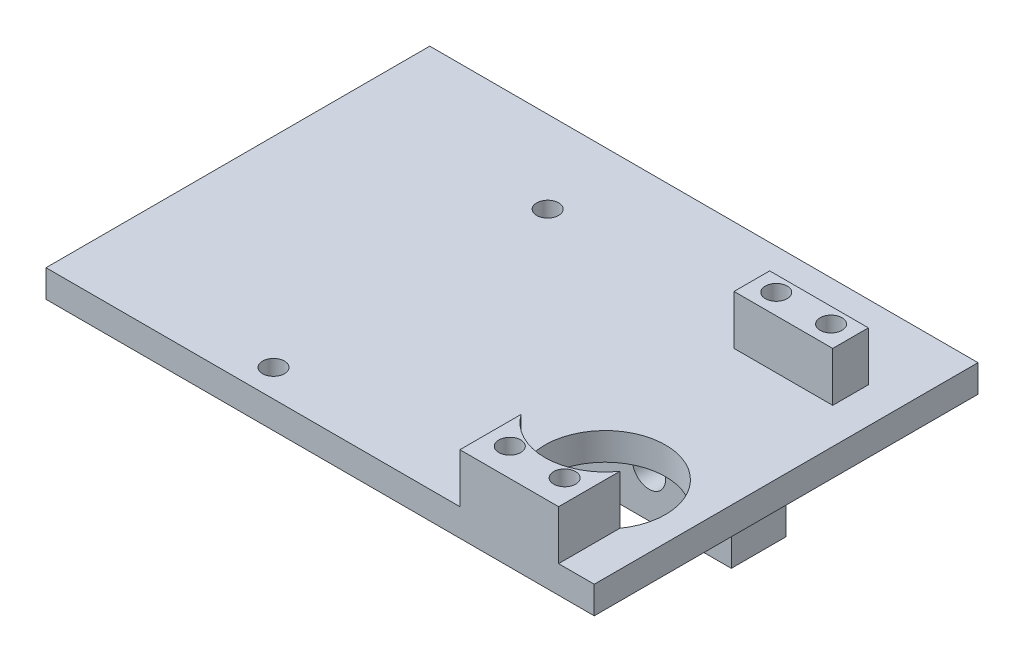
from build123d import *

# Parameters (mm, degrees)
SKETCH1_W           = 100
SKETCH1_H           = 70
SKETCH1_R           = 11
BOSS_EXTRUDE1_DEPTH = 5
SKETCH2_W           = 18
SKETCH2_H           = 6.5
BOSS_EXTRUDE2_DEPTH = 9
SKETCH3_R           = 2
CUT_EXTRUDE1_DEPTH  = 3
SKETCH4_R           = 3
BOSS_EXTRUDE4_DEPTH = 10
FILLET2_R           = 3
SKETCH5_R           = 2
CUT_EXTRUDE2_DEPTH  = 5


with BuildPart() as part:
    # Sketch1 → Boss-Extrude1 (new body)
    with BuildSketch(Plane(origin=(0, 0, 0), x_dir=(1, 0, 0), z_dir=(0, 1, 0))):
        Rectangle(SKETCH1_W, SKETCH1_H)
        with Locations(Location((34.5, -17.5, 0), (0, 0, 270))):
            Circle(SKETCH1_R, mode=Mode.SUBTRACT)
    extrude(amount=BOSS_EXTRUDE1_DEPTH)

    # Sketch2 → Boss-Extrude2 (add)
    with BuildSketch(Plane(origin=(0, 5, 0), x_dir=(1, 0, 0), z_dir=(0, 1, 0))):
        with BuildLine():
            Line((25.5, -35), (25.5, -23.82455532))
            ThreePointArc((25.5, -23.82455532), (34.5, -28.5), (43.5, -23.82455532))
            Line((43.5, -23.82455532), (43.5, -35))
            Line((43.5, -35), (25.5, -35))
        make_face()
        with Locations((34.5, 18.25)):
            Rectangle(SKETCH2_W, SKETCH2_H)
    extrude(amount=BOSS_EXTRUDE2_DEPTH)

    # Sketch3 → Cut-Extrude1 (cut)
    with BuildSketch(Plane(origin=(0, 14, 0), x_dir=(1, 0, 0), z_dir=(0, 1, 0))):
        with Locations(Location((29.5, -29.9, 0), (0, 0, 270))):
            Circle(SKETCH3_R)
        with Locations(Location((39.5, -29.9, 0), (0, 0, 270))):
            Circle(SKETCH3_R)
        with Locations(Location((39.5, 18.7, 0), (0, 0, 270))):
            Circle(SKETCH3_R)
        with Locations(Location((29.5, 18.7, 0), (0, 0, 270))):
            Circle(SKETCH3_R)
    extrude(amount=-CUT_EXTRUDE1_DEPTH, mode=Mode.SUBTRACT)

    # Sketch4 → Boss-Extrude4 (add)
    # profile 1 of 3: a face of its own
    with BuildSketch(Plane(origin=(0, 0, -35), x_dir=(-1, 0, 0), z_dir=(0, 0, -1))):
        Polygon((-15, -40), (15, -40), (15, -7), (15, 0), (-15, 0), (-15, -7), align=None)
        with Locations((0, -32)):
            Circle(SKETCH4_R, mode=Mode.SUBTRACT)
        with Locations((0, -8)):
            Circle(SKETCH4_R, mode=Mode.SUBTRACT)
    # profile 2 of 3: a face of its own
    with BuildSketch(Plane(origin=(0, 0, -35), x_dir=(-1, 0, 0), z_dir=(0, 0, -1))):
        Polygon((-50, 0), (-15, -7), (-15, 0), align=None)
    # profile 3 of 3: a face of its own
    with BuildSketch(Plane(origin=(0, 0, -35), x_dir=(-1, 0, 0), z_dir=(0, 0, -1))):
        Polygon((15, 0), (15, -7), (50, 0), align=None)
    extrude(amount=-BOSS_EXTRUDE4_DEPTH)

    # Fillet2
    fillet2_edges = [part.edges().sort_by_distance(p)[0] for p in [
        (15, -7, -30),
        (-15, -7, -30),
        (0, 0, -25),
    ]]
    fillet(fillet2_edges, radius=FILLET2_R)

    # Sketch5 → Cut-Extrude2 (cut)
    with BuildSketch(Plane(origin=(0, 5, 0), x_dir=(1, 0, 0), z_dir=(0, 1, 0))):
        with Locations(Location((-13.5, -30, 0), (0, 0, 270))):
            Circle(SKETCH5_R)
        with Locations(Location((-13.5, 20, 0), (0, 0, 270))):
            Circle(SKETCH5_R)
    extrude(amount=-CUT_EXTRUDE2_DEPTH, mode=Mode.SUBTRACT)


solid = part.part
